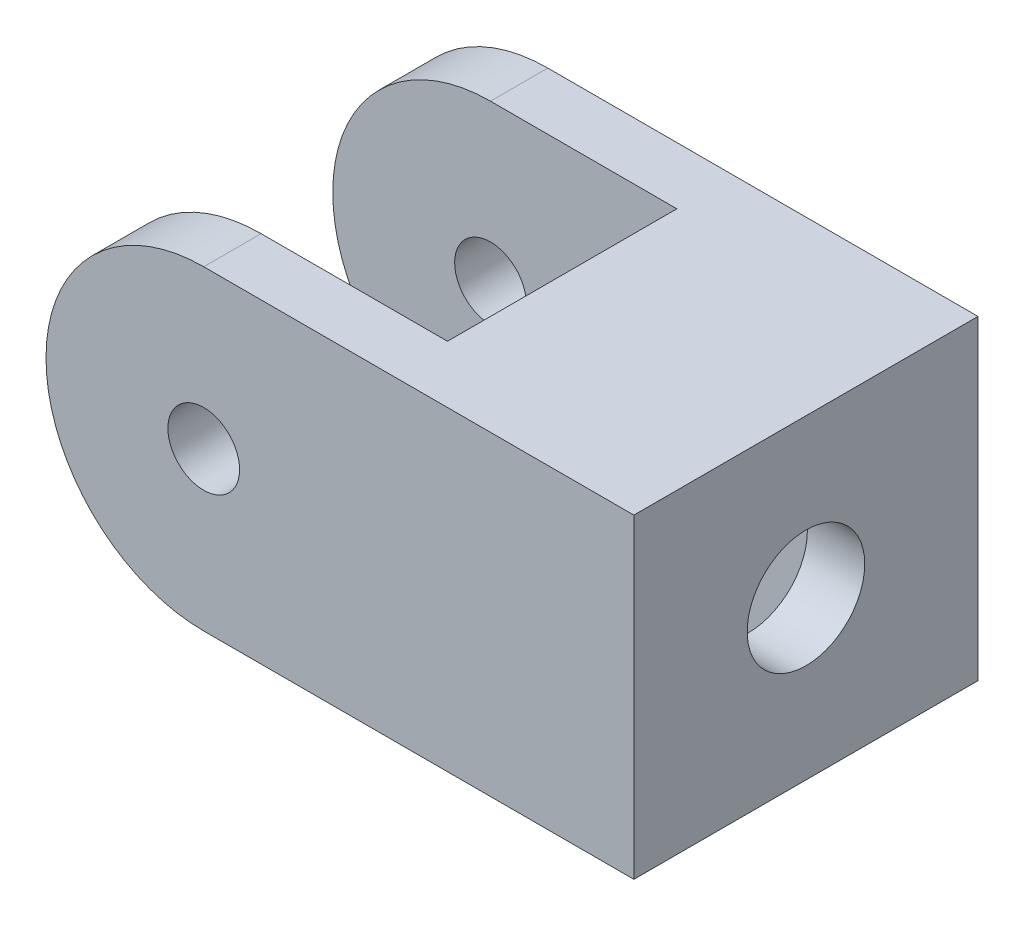
from build123d import *

# Parameters (mm, degrees)
SKETCH1_R           = 2.5
BOSS_EXTRUDE1_DEPTH = 24
SKETCH2_W           = 24
SKETCH2_H           = 16
CUT_EXTRUDE1_DEPTH  = 45.271887242
CUT_EXTRUDE2_DEPTH  = 6.8
CUT_EXTRUDE3_REACH  = 50.765
SKETCH6_R           = 4.1


with BuildPart() as part:
    # Sketch1 → Boss-Extrude1 (new body)
    with BuildSketch(Plane.XY):
        with BuildLine():
            Line((0, 11), (30, 11))
            Line((30, 11), (30, -11))
            Line((30, -11), (0, -11))
            ThreePointArc((0, -11), (-11, 0), (0, 11))
        make_face()
        Circle(SKETCH1_R, mode=Mode.SUBTRACT)
    extrude(amount=BOSS_EXTRUDE1_DEPTH)

    # Sketch2 → Cut-Extrude1 (cut, through all)
    with BuildSketch(Plane(origin=(0, 11, 0), x_dir=(1, 0, 0), z_dir=(0, 1, 0))):
        with Locations((1, -12)):
            Rectangle(SKETCH2_W, SKETCH2_H)
    extrude(amount=-CUT_EXTRUDE1_DEPTH, mode=Mode.SUBTRACT)

    # Sketch4 → Cut-Extrude2 (cut)
    with BuildSketch(Plane(origin=(26, 0, 0), x_dir=(0, 0, -1), z_dir=(1, 0, 0))):
        Polygon((-18.5, 3.75277675), (-18.5, -11), (-5.5, -11), (-5.5, 3.75277675), (-12, 7.505553499), align=None)
    extrude(amount=-CUT_EXTRUDE2_DEPTH, mode=Mode.SUBTRACT)

    # Cut-Extrude3: up to this face of the body (flat: up to its plane)
    cut_extrude3_end = Plane(part.part.faces().sort_by_distance((13, 0, 12))[0])
    # Sketch6 → Cut-Extrude3 (cut, up to the picked face)
    with BuildSketch(Plane(origin=(30, 0, 0), x_dir=(0, 0, -1), z_dir=(1, 0, 0)), mode=Mode.PRIVATE) as cut_extrude3_sk1:
        with Locations((-12, 0)):
            Circle(SKETCH6_R)
    cut_extrude3_tool1 = split(extrude(cut_extrude3_sk1.sketch, amount=-CUT_EXTRUDE3_REACH, mode=Mode.PRIVATE), bisect_by=cut_extrude3_end, keep=Keep.BOTH, mode=Mode.PRIVATE)
    add(cut_extrude3_tool1.solids().sort_by(Axis((30, 0, 12), (-1, 0, 0)))[0], mode=Mode.SUBTRACT)


solid = part.part
